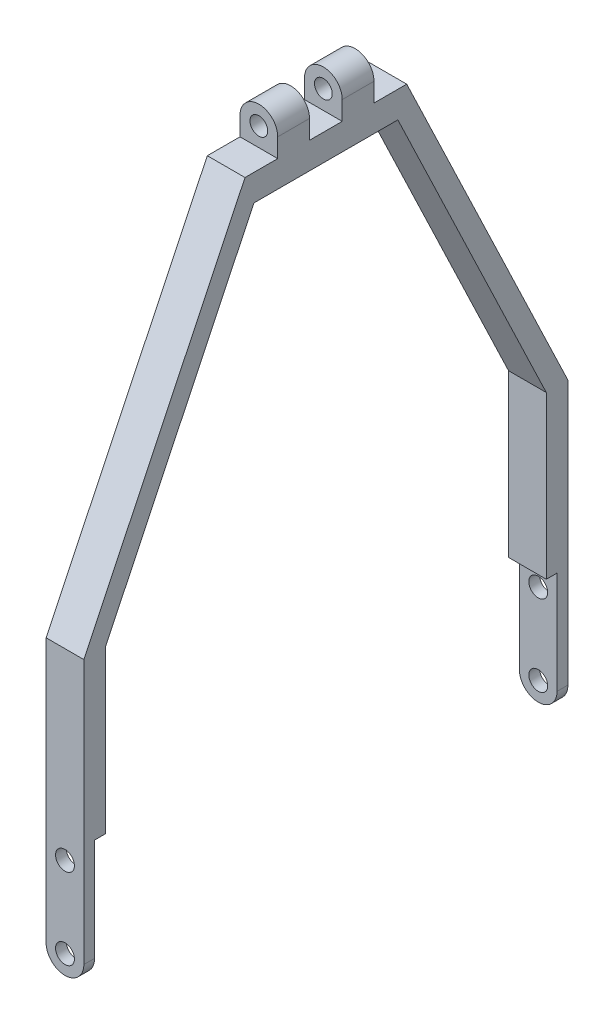
from build123d import *

# Parameters (mm, degrees)
CROQUIS1_R              = 1.75
CROQUIS1_R_2            = 1.65
SALIENTE_EXTRUIR1_DEPTH = 89.8
CROQUIS2_W              = 6.07
CROQUIS2_H              = 7
CORTAR_EXTRUIR1_DEPTH   = 138.205284155


with BuildPart() as part:
    # Croquis1 → Saliente-Extruir1 (new body)
    with BuildSketch(Plane.XY):
        with BuildLine():
            Line((-3.5, 100), (-3.5, -15))
            ThreePointArc((-3.5, -15), (0, -18.5), (3.5, -15))
            Line((3.5, -15), (3.5, 100))
            ThreePointArc((3.5, 100), (0, 103.5), (-3.5, 100))
        make_face()
        Circle(CROQUIS1_R, mode=Mode.SUBTRACT)
        with Locations((0, -15)):
            Circle(CROQUIS1_R, mode=Mode.SUBTRACT)
        with Locations((0, 100)):
            Circle(CROQUIS1_R_2, mode=Mode.SUBTRACT)
    extrude(amount=-SALIENTE_EXTRUIR1_DEPTH)

    # Croquis2 → Cortar-Extruir1 (cut, through all)
    with BuildSketch(Plane(origin=(3.5, 0, 0), x_dir=(0, 0, -1), z_dir=(1, 0, 0))):
        Polygon((2, 4), (2, -18.5), (87.8, -18.5), (87.8, 4), (85.8, 4), (85.8, 34), (58.253185901, 91.58113315), (31.546814099, 91.58113315), (4, 34), (4, 4), align=None)
        with Locations((44.9, 100)):
            Rectangle(CROQUIS2_W, CROQUIS2_H)
        Polygon((0, 34), (29.9, 96.5), (35.97, 96.5), (35.97, 103.5), (0, 103.5), align=None)
        Polygon((59.9, 96.5), (89.8, 34), (89.8, 103.5), (53.83, 103.5), (53.83, 96.5), align=None)
    extrude(amount=-CORTAR_EXTRUIR1_DEPTH, mode=Mode.SUBTRACT)


solid = part.part
